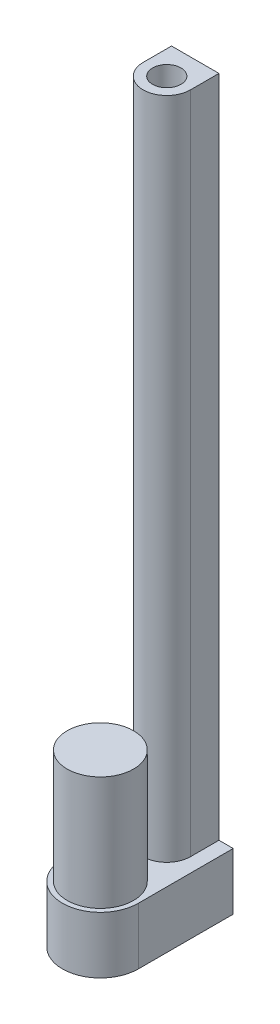
from build123d import *

# Parameters (mm, degrees)
BOSS_EXTRUDE1_DEPTH     = 30
SKETCH2_R               = 17.5
BOSS_EXTRUDE2_DEPTH     = 60
BOSS_EXTRUDE3_DEPTH     = 350
CUT_EXTRUDE1_DEPTH      = 387.910842443
CUT_EXTRUDE1_DEPTH_BACK = 350
SKETCH4_R               = 7.5
SKETCH5_W               = 10
SKETCH5_H               = 10
BOSS_EXTRUDE4_DEPTH     = 15
SKETCH6_R               = 3
CUT_EXTRUDE2_DEPTH      = 388.201497931


with BuildPart() as part:
    # Sketch1 → Boss-Extrude1 (new body)
    with BuildSketch(Plane(origin=(0, 0, 0), x_dir=(1, 0, 0), z_dir=(0, 1, 0))):
        with BuildLine():
            Line((-20, -50), (-20, 0))
            Line((-20, 0), (20, 0))
            Line((20, 0), (20, -50))
            ThreePointArc((20, -50), (0, -70), (-20, -50))
        make_face()
    extrude(amount=BOSS_EXTRUDE1_DEPTH)

    # Sketch2 → Boss-Extrude2 (add)
    with BuildSketch(Plane(origin=(0, 30, 0), x_dir=(1, 0, 0), z_dir=(0, 1, 0))):
        with Locations(Location((0, -50, 0), (0, 0, 90))):
            Circle(SKETCH2_R)
    extrude(amount=BOSS_EXTRUDE2_DEPTH)

    # Sketch3 → Boss-Extrude3 (add)
    with BuildSketch(Plane(origin=(0, 30, 0), x_dir=(1, 0, 0), z_dir=(0, 1, 0))):
        with BuildLine():
            Line((-12.5, 0), (-12.5, -15))
            ThreePointArc((-12.5, -15), (0, -27.5), (12.5, -15))
            Line((12.5, -15), (12.5, 0))
            Line((12.5, 0), (-12.5, 0))
        make_face()
    extrude(amount=BOSS_EXTRUDE3_DEPTH)

    # Sketch4 → Cut-Extrude1 (cut, two sides: drawn at the far end of the back side and taken through both)
    with BuildSketch(Plane(origin=(0, 380, 0), x_dir=(1, 0, 0), z_dir=(0, 1, 0)).offset(-CUT_EXTRUDE1_DEPTH_BACK)):
        with Locations(Location((0, -15, 0), (0, 0, 90))):
            Circle(SKETCH4_R)
    extrude(amount=CUT_EXTRUDE1_DEPTH + CUT_EXTRUDE1_DEPTH_BACK, mode=Mode.SUBTRACT)

    # Sketch5 → Boss-Extrude4 (add)
    with BuildSketch(Plane(origin=(0, 0, 0), x_dir=(-1, 0, 0), z_dir=(0, -1, 0))):
        with Locations((0, -10)):
            Rectangle(SKETCH5_W, SKETCH5_H)
    extrude(amount=BOSS_EXTRUDE4_DEPTH)

    # Sketch6 → Cut-Extrude2 (cut, through all)
    with BuildSketch(Plane(origin=(5, 0, 0), x_dir=(0, 0, -1), z_dir=(1, 0, 0))):
        with Locations((-10, -10)):
            Circle(SKETCH6_R)
    extrude(amount=-CUT_EXTRUDE2_DEPTH, mode=Mode.SUBTRACT)


solid = part.part
